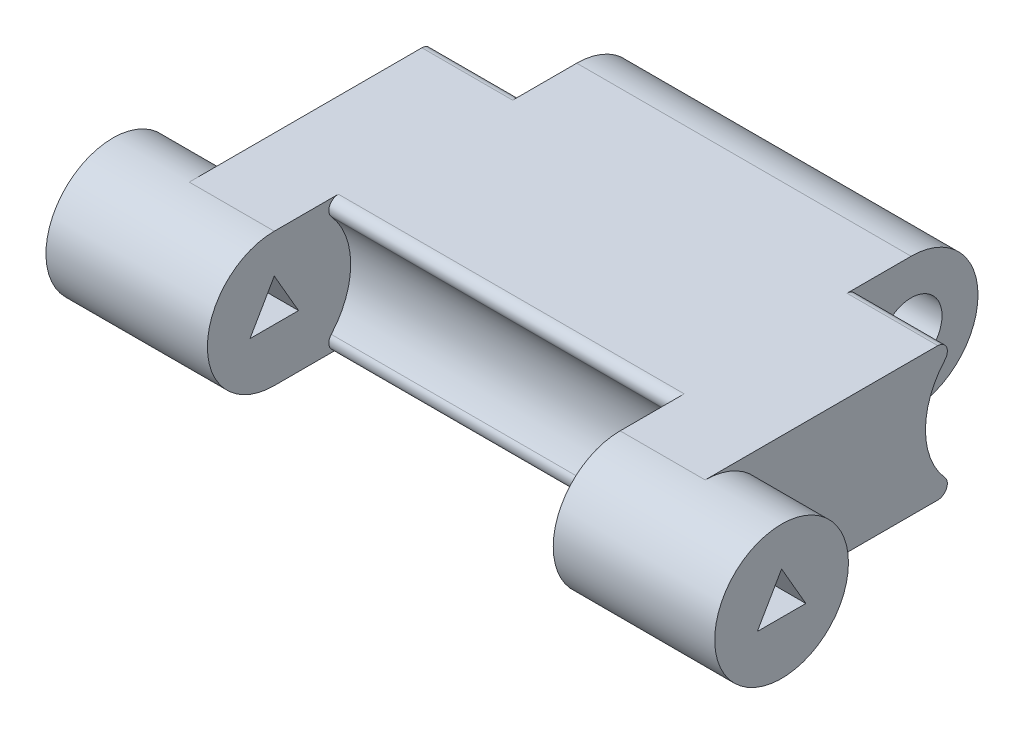
from build123d import *

# Parameters (mm, degrees)
EXTRUDE_1_DEPTH     = 17.5
SKETCH_3_W          = 24
SKETCH_3_H          = 9
SKETCH_3_R          = 3.5
CUT_EXTRUDE_1_DEPTH = 4
SKETCH_6_R          = 4
CUT_EXTRUDE_2_DEPTH = 9.05
SKETCH_7_R          = 4
CUT_EXTRUDE_3_DEPTH = 4.75
SKETCH_8_R          = 1.616666667
CUT_EXTRUDE_4_DEPTH = 38.428601697
FILLET_1_R          = 0.5
EXTRUDE_START       = -1
SKETCH_9_R          = 3.5
SKETCH_9_R_2        = 0.75
EXTRUDE_2_DEPTH     = 1


with BuildPart() as part:
    # Эскиз1 → Бобышка-Вытянуть1 (new, symmetric)
    with BuildSketch(Plane(origin=(0, 0, 0), x_dir=(0, 0, -1), z_dir=(1, 0, 0))):
        with BuildLine():
            Line((-7.765, 7), (7.765, 7))
            ThreePointArc((7.765, 7), (11.265, 3.5), (7.765, 0))
            Line((7.765, 0), (-7.765, 0))
            ThreePointArc((-7.765, 0), (-11.265, 3.5), (-7.765, 7))
        make_face()
    extrude(amount=EXTRUDE_1_DEPTH, both=True)

    # Эскиз3 → Вырез-Вытянуть1 (cut)
    with BuildSketch(Plane(origin=(17.5, 0, 0), x_dir=(0, 0, -1), z_dir=(1, 0, 0))):
        with Locations((0, 3.5)):
            Rectangle(SKETCH_3_W, SKETCH_3_H)
        with Locations(Location((-7.765, 3.5, 0), (0, 0, 90))):
            Circle(SKETCH_3_R, mode=Mode.SUBTRACT)
    cut_extrude_1 = extrude(amount=-CUT_EXTRUDE_1_DEPTH, mode=Mode.SUBTRACT)

    # Зеркальное отражение1: Вырез-Вытянуть1 across plane
    add(cut_extrude_1.mirror(Plane(origin=(0, 0, 0), x_dir=(0, 0, 1), z_dir=(1, 0, 0))), mode=Mode.SUBTRACT)

    # Эскиз6 → Вырез-Вытянуть2 (cut, symmetric)
    with BuildSketch(Plane(origin=(0, 0, 0), x_dir=(0, 0, -1), z_dir=(1, 0, 0))):
        with Locations((-7.765, 3.5)):
            Circle(SKETCH_6_R)
    extrude(amount=CUT_EXTRUDE_2_DEPTH, both=True, mode=Mode.SUBTRACT)

    # Эскиз7 → Вырез-Вытянуть3 (cut)
    with BuildSketch(Plane(origin=(13.5, 0, 0), x_dir=(0, 0, -1), z_dir=(1, 0, 0))):
        with Locations((7.765, 3.5)):
            Circle(SKETCH_7_R)
    cut_extrude_3 = extrude(amount=-CUT_EXTRUDE_3_DEPTH, mode=Mode.SUBTRACT)

    # Зеркальное отражение2: Вырез-Вытянуть3 across plane
    add(cut_extrude_3.mirror(Plane(origin=(0, 0, 0), x_dir=(0, 0, 1), z_dir=(1, 0, 0))), mode=Mode.SUBTRACT)

    # Эскиз8 → Вырез-Вытянуть4 (cut, through all)
    with BuildSketch(Plane(origin=(17.5, 0, 0), x_dir=(0, 0, -1), z_dir=(1, 0, 0))):
        with Locations((7.765, 3.5)):
            Circle(SKETCH_8_R)
        Polygon((-9.035170592, 2.766666667), (-7.765, 4.966666667), (-6.494829408, 2.766666667), align=None)
    extrude(amount=-CUT_EXTRUDE_4_DEPTH, mode=Mode.SUBTRACT)

    # Скругление1
    fillet_1_edges = [part.edges().sort_by_distance(p)[0] for p in [
        (0, 7, 5.828508327),
        (0, 0, 5.828508327),
        (11.125, 0, -5.828508327),
        (11.125, 7, -5.828508327),
        (-11.125, 0, -5.828508327),
        (-11.125, 7, -5.828508327),
    ]]
    fillet(fillet_1_edges, radius=FILLET_1_R)

    # Эскиз9 → Бобышка-Вытянуть2 (add)
    with BuildSketch(Plane.ZY.offset(17.5).offset(EXTRUDE_START)):
        with Locations(Location((7.765, 3.5, 0), (0, 0, 90))):
            Circle(SKETCH_9_R)
        with Locations((7.765, 3.5)):
            Circle(SKETCH_9_R_2, mode=Mode.SUBTRACT)
    extrude(amount=EXTRUDE_2_DEPTH)


solid = part.part
